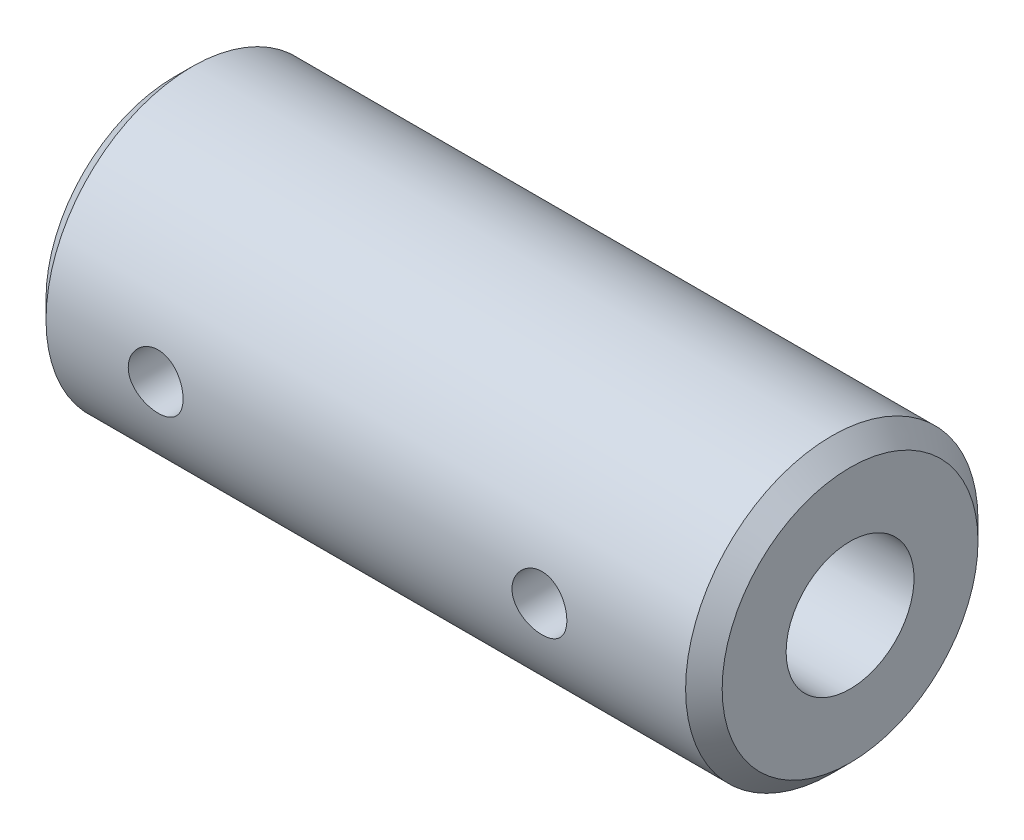
from build123d import *

# Parameters (mm, degrees)
ESBO_O2_R             = 1.5
CORTE_EXTRUS_O1_DEPTH = 121.149937162


with BuildPart() as part:
    # Esboço1 → Revolução1 (revolve)
    with BuildSketch(Plane.XY, mode=Mode.PRIVATE) as revolu_o1_sk:
        Polygon((81.95, -3.93), (81.95, 0.07), (82.95, 1.07), (117.95, 1.07), (118.95, 0.07), (118.95, -3.43), (102.7, -3.43), (101.7, -3.93), (101.7, -6.93), (97.95, -6.93), (97.95, -4.93), (96.95, -3.93), align=None)
    revolve(revolu_o1_sk.sketch.rotate(Axis((81.95, -6.93, 0), (1, 0, 0)), 90), axis=Axis((81.95, -6.93, 0), (1, 0, 0)))

    # Esboço2 → Corte-extrusão1 (cut, through all)
    with BuildSketch(Plane.XY):
        with Locations(Location((88.95, -6.93, 0), (0, 0, 180))):
            Circle(ESBO_O2_R)
        with Locations(Location((109.95, -6.93, 0), (0, 0, 180))):
            Circle(ESBO_O2_R)
    extrude(amount=CORTE_EXTRUS_O1_DEPTH, mode=Mode.SUBTRACT)


solid = part.part
